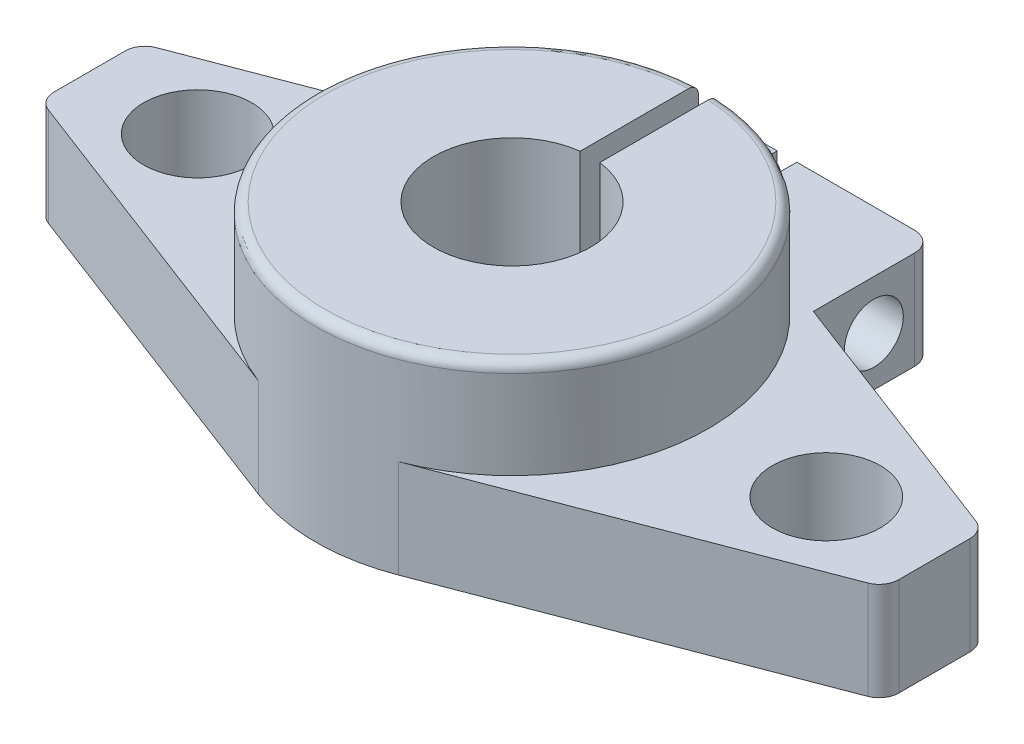
from build123d import *

# Parameters (mm, degrees)
SKETCH1_R           = 2.75
BOSS_EXTRUDE1_DEPTH = 5
BOSS_EXTRUDE2_DEPTH = 5
RADYUS2_R           = 0.5
RADYUS3_R           = 1
RADYUS4_R           = 1
SKETCH3_R           = 1.5
CUT_EXTRUDE1_DEPTH  = 34.719430671
RADYUS5_R           = 1


with BuildPart() as part:
    # Sketch1 → Boss-Extrude1 (new body)
    with BuildSketch(Plane(origin=(0, 0, 0), x_dir=(1, 0, 0), z_dir=(0, 1, 0))):
        with BuildLine():
            Line((-21.5, 2.5), (-21.5, -2.5))
            Line((-21.5, -2.5), (-3.564762336, -9.343043909))
            ThreePointArc((-3.564762336, -9.343043909), (0, -10), (3.564762336, -9.343043909))
            Line((3.564762336, -9.343043909), (21.5, -2.5))
            Line((21.5, -2.5), (21.5, 2.5))
            Line((21.5, 2.5), (7.5, 7.841586018))
            Line((7.5, 7.841586018), (7.5, 14))
            Line((7.5, 14), (0.5, 14))
            Line((0.5, 14), (0.5, 9.987492178))
            Line((0.5, 9.987492178), (0.5, 3.968626967))
            ThreePointArc((0.5, 3.968626967), (0, -4), (-0.5, 3.968626967))
            Line((-0.5, 3.968626967), (-0.5, 9.987492178))
            Line((-0.5, 9.987492178), (-0.5, 14))
            Line((-0.5, 14), (-7.5, 14))
            Line((-7.5, 14), (-7.5, 7.841586018))
            Line((-7.5, 7.841586018), (-21.5, 2.5))
        make_face()
        with Locations(Location((-16, 0, 0), (0, 0, 270))):
            Circle(SKETCH1_R, mode=Mode.SUBTRACT)
        with Locations(Location((16, 0, 0), (0, 0, 270))):
            Circle(SKETCH1_R, mode=Mode.SUBTRACT)
    extrude(amount=BOSS_EXTRUDE1_DEPTH)

    # Sketch2 → Boss-Extrude2 (add)
    with BuildSketch(Plane(origin=(0, 5, 0), x_dir=(1, 0, 0), z_dir=(0, 1, 0))):
        with BuildLine():
            Line((-0.5, 3.968626967), (-0.5, 9.987492178))
            ThreePointArc((-0.5, 9.987492178), (0, -10), (0.5, 9.987492178))
            Line((0.5, 9.987492178), (0.5, 3.968626967))
            ThreePointArc((0.5, 3.968626967), (0, -4), (-0.5, 3.968626967))
        make_face()
    extrude(amount=BOSS_EXTRUDE2_DEPTH)

    # Radyus2
    radyus2_edges = [part.edges().sort_by_distance(p)[0] for p in [
        (0, 10, 10),
    ]]
    fillet(radyus2_edges, radius=RADYUS2_R)

    # Radyus3
    radyus3_edges = [part.edges().sort_by_distance(p)[0] for p in [
        (21.5, 2.5, 2.5),
    ]]
    fillet(radyus3_edges, radius=RADYUS3_R)

    # Radyus4
    radyus4_edges = [part.edges().sort_by_distance(p)[0] for p in [
        (-21.5, 2.5, -2.5),
        (-21.5, 2.5, 2.5),
        (21.5, 2.5, -2.5),
    ]]
    fillet(radyus4_edges, radius=RADYUS4_R)

    # Sketch3 → Cut-Extrude1 (cut, through all)
    with BuildSketch(Plane(origin=(7.5, 0, 0), x_dir=(0, 0, -1), z_dir=(1, 0, 0))):
        with Locations((10.920793009, 2.5)):
            Circle(SKETCH3_R)
    extrude(amount=-CUT_EXTRUDE1_DEPTH, mode=Mode.SUBTRACT)

    # Radyus5
    radyus5_edges = [part.edges().sort_by_distance(p)[0] for p in [
        (7.5, 2.5, -14),
        (-7.5, 2.5, -14),
    ]]
    fillet(radyus5_edges, radius=RADYUS5_R)


solid = part.part
